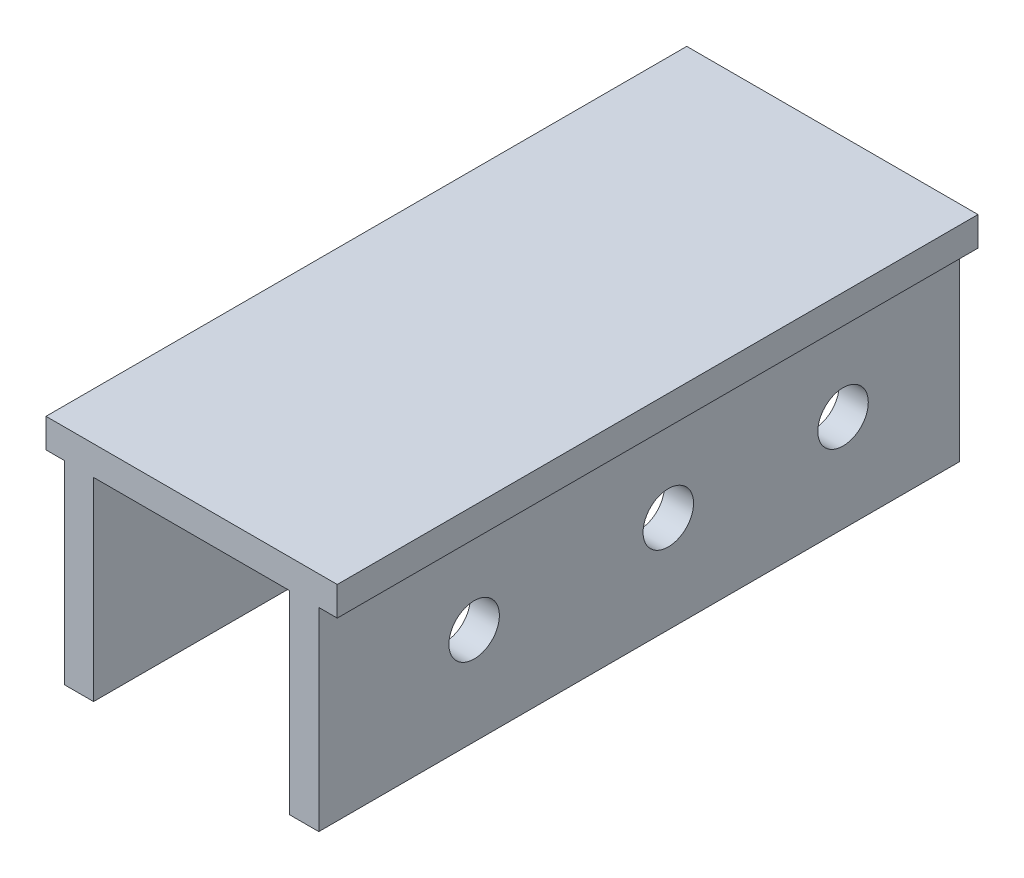
from build123d import *

# Parameters (mm, degrees)
EXTRUDE_1_DEPTH     = 66
HOLE_WIZARD_1_D     = 5.2
HOLE_WIZARD_1_DEPTH = 100


with BuildPart() as part:
    # 草图1 → 凸台-拉伸1 (new body)
    with BuildSketch(Plane.XY):
        Polygon((-15, -1.5), (-13.1, -1.5), (-13.1, -21.5), (-10.1, -21.5), (-10.1, -1.5), (10.1, -1.5), (10.1, -21.5), (13.1, -21.5), (13.1, -1.5), (15, -1.5), (15, 1.5), (-15, 1.5), align=None)
    extrude(amount=EXTRUDE_1_DEPTH)

    # 孔1
    with Locations(Plane(origin=(13.1, 0, 0), x_dir=(0, 0, -1), z_dir=(1, 0, 0))):
        with Locations((-50, -11.5), (-30, -11.5), (-12, -11.5)):
            Hole(HOLE_WIZARD_1_D / 2, depth=HOLE_WIZARD_1_DEPTH)


solid = part.part
